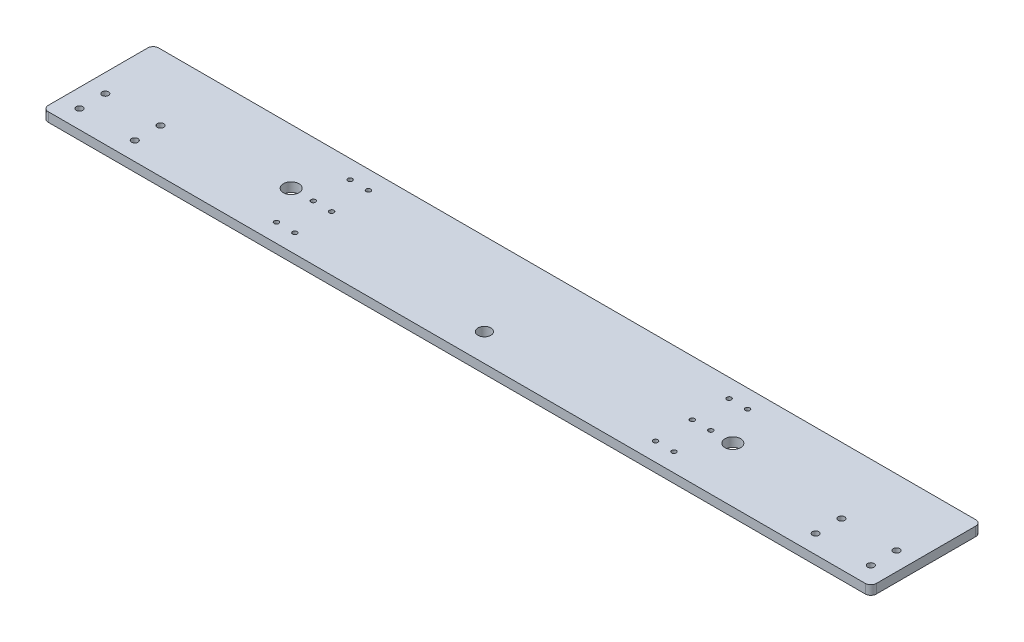
from build123d import *

# Parameters (mm, degrees)
SKETCH_1_W                  = 450
SKETCH_1_H                  = 60
EXTRUDE_1_DEPTH             = 5
SKETCH_2_R                  = 3.5
CUT_EXTRUDE_2_DEPTH         = 228.046250795
SKETCH_4_R                  = 1
CUT_EXTRUDE_4_DEPTH         = 228.046250795
PATTERN_LINEAR_2_COUNT      = 3
PATTERN_LINEAR_2_PITCH      = 20
PATTERN_LINEAR_2_COUNT_DIR2 = 2
PATTERN_LINEAR_2_PITCH_DIR2 = 10
MIRROR_1_COPY_1_SKETCH_R    = 1
MIRROR_1_COPY_1_DEPTH       = 228.046250795
MIRROR_1_COPY_2_SKETCH_R    = 1
MIRROR_1_COPY_2_DEPTH       = 228.046250795
MIRROR_1_COPY_3_SKETCH_R    = 1
MIRROR_1_COPY_3_DEPTH       = 228.046250795
MIRROR_1_COPY_4_SKETCH_R    = 1
MIRROR_1_COPY_4_DEPTH       = 228.046250795
MIRROR_1_COPY_5_SKETCH_R    = 1
MIRROR_1_COPY_5_DEPTH       = 228.046250795
SKETCH_6_R                  = 1.75
CUT_EXTRUDE_5_DEPTH         = 228.046250795
PATTERN_LINEAR_3_COUNT      = 2
PATTERN_LINEAR_3_PITCH      = 14
PATTERN_LINEAR_3_COUNT_DIR2 = 2
PATTERN_LINEAR_3_PITCH_DIR2 = 30
MIRROR_2_COPY_1_SKETCH_R    = 1.75
MIRROR_2_COPY_1_DEPTH       = 228.046250795
MIRROR_2_COPY_2_SKETCH_R    = 1.75
MIRROR_2_COPY_2_DEPTH       = 228.046250795
MIRROR_2_COPY_3_SKETCH_R    = 1.75
MIRROR_2_COPY_3_DEPTH       = 228.046250795
SKETCH_7_R                  = 4.25
CUT_EXTRUDE_6_DEPTH         = 10
FILLET_3_R                  = 3
FILLET_4_R                  = 3
FILLET_5_R                  = 3
FILLET_6_R                  = 3
HOLE_WIZARD_M3_2_D          = 2.5


with BuildPart() as part:
    # 草图1 → 凸台-拉伸1 (new body)
    with BuildSketch(Plane(origin=(0, 0, 0), x_dir=(1, 0, 0), z_dir=(0, 1, 0))):
        Rectangle(SKETCH_1_W, SKETCH_1_H)
    extrude(amount=-EXTRUDE_1_DEPTH)

    # 草图2 → 切除-拉伸2 (cut, through all)
    with BuildSketch(Plane(origin=(0, 0, 0), x_dir=(1, 0, 0), z_dir=(0, 1, 0))):
        with Locations(Location((0, -15, 0), (0, 0, 270))):
            Circle(SKETCH_2_R)
    extrude(amount=-CUT_EXTRUDE_2_DEPTH, mode=Mode.SUBTRACT)

    # 草图4 → 切除-拉伸4 (cut, through all)
    with BuildSketch(Plane(origin=(0, 0, 0), x_dir=(1, 0, 0), z_dir=(0, 1, 0))):
        with Locations(Location((-98, -20, 0), (0, 0, 270))):
            Circle(SKETCH_4_R)
    cut_extrude_4 = extrude(amount=-CUT_EXTRUDE_4_DEPTH, mode=Mode.SUBTRACT)

    # 阵列(线性)2: Cut-Extrude 4 3 × 2
    with Locations(*[(-j * PATTERN_LINEAR_2_PITCH_DIR2, 0, -i * PATTERN_LINEAR_2_PITCH) for i in range(PATTERN_LINEAR_2_COUNT) for j in range(PATTERN_LINEAR_2_COUNT_DIR2) if (i, j) != (0, 0)]):
        add(cut_extrude_4, mode=Mode.SUBTRACT)

    # 镜向1: 切除-拉伸4 across plane
    add(cut_extrude_4.mirror(Plane(origin=(0, 0, 0), x_dir=(0, 0, 1), z_dir=(1, 0, 0))), mode=Mode.SUBTRACT)

    # 镜向1 copy 1 sketch → 镜向1 copy 1 (cut, through all)
    with BuildSketch(Plane(origin=(10, 0, 0), x_dir=(-1, 0, 0), z_dir=(0, 1, 0))):
        with Locations((-98, 20)):
            Circle(MIRROR_1_COPY_1_SKETCH_R)
    extrude(amount=-MIRROR_1_COPY_1_DEPTH, mode=Mode.SUBTRACT)

    # 镜向1 copy 2 sketch → 镜向1 copy 2 (cut, through all)
    with BuildSketch(Plane(origin=(0, 0, -20), x_dir=(-1, 0, 0), z_dir=(0, 1, 0))):
        with Locations((-98, 20)):
            Circle(MIRROR_1_COPY_2_SKETCH_R)
    extrude(amount=-MIRROR_1_COPY_2_DEPTH, mode=Mode.SUBTRACT)

    # 镜向1 copy 3 sketch → 镜向1 copy 3 (cut, through all)
    with BuildSketch(Plane(origin=(10, 0, -20), x_dir=(-1, 0, 0), z_dir=(0, 1, 0))):
        with Locations((-98, 20)):
            Circle(MIRROR_1_COPY_3_SKETCH_R)
    extrude(amount=-MIRROR_1_COPY_3_DEPTH, mode=Mode.SUBTRACT)

    # 镜向1 copy 4 sketch → 镜向1 copy 4 (cut, through all)
    with BuildSketch(Plane(origin=(0, 0, -40), x_dir=(-1, 0, 0), z_dir=(0, 1, 0))):
        with Locations((-98, 20)):
            Circle(MIRROR_1_COPY_4_SKETCH_R)
    extrude(amount=-MIRROR_1_COPY_4_DEPTH, mode=Mode.SUBTRACT)

    # 镜向1 copy 5 sketch → 镜向1 copy 5 (cut, through all)
    with BuildSketch(Plane(origin=(10, 0, -40), x_dir=(-1, 0, 0), z_dir=(0, 1, 0))):
        with Locations((-98, 20)):
            Circle(MIRROR_1_COPY_5_SKETCH_R)
    extrude(amount=-MIRROR_1_COPY_5_DEPTH, mode=Mode.SUBTRACT)

    # 草图6 → 切除-拉伸5 (cut, through all)
    with BuildSketch(Plane(origin=(0, 0, 0), x_dir=(1, 0, 0), z_dir=(0, 1, 0))):
        with Locations(Location((-215, -20, 0), (0, 0, 270))):
            Circle(SKETCH_6_R)
    cut_extrude_5 = extrude(amount=-CUT_EXTRUDE_5_DEPTH, mode=Mode.SUBTRACT)

    # 阵列(线性)3: Cut-Extrude 5 2 × 2
    with Locations(*[(j * PATTERN_LINEAR_3_PITCH_DIR2, 0, -i * PATTERN_LINEAR_3_PITCH) for i in range(PATTERN_LINEAR_3_COUNT) for j in range(PATTERN_LINEAR_3_COUNT_DIR2) if (i, j) != (0, 0)]):
        add(cut_extrude_5, mode=Mode.SUBTRACT)

    # 镜向2: 切除-拉伸5 across plane
    add(cut_extrude_5.mirror(Plane(origin=(0, 0, 0), x_dir=(0, 0, 1), z_dir=(1, 0, 0))), mode=Mode.SUBTRACT)

    # 镜向2 copy 1 sketch → 镜向2 copy 1 (cut, through all)
    with BuildSketch(Plane(origin=(-30, 0, 0), x_dir=(-1, 0, 0), z_dir=(0, 1, 0))):
        with Locations((-215, 20)):
            Circle(MIRROR_2_COPY_1_SKETCH_R)
    extrude(amount=-MIRROR_2_COPY_1_DEPTH, mode=Mode.SUBTRACT)

    # 镜向2 copy 2 sketch → 镜向2 copy 2 (cut, through all)
    with BuildSketch(Plane(origin=(0, 0, -14), x_dir=(-1, 0, 0), z_dir=(0, 1, 0))):
        with Locations((-215, 20)):
            Circle(MIRROR_2_COPY_2_SKETCH_R)
    extrude(amount=-MIRROR_2_COPY_2_DEPTH, mode=Mode.SUBTRACT)

    # 镜向2 copy 3 sketch → 镜向2 copy 3 (cut, through all)
    with BuildSketch(Plane(origin=(-30, 0, -14), x_dir=(-1, 0, 0), z_dir=(0, 1, 0))):
        with Locations((-215, 20)):
            Circle(MIRROR_2_COPY_3_SKETCH_R)
    extrude(amount=-MIRROR_2_COPY_3_DEPTH, mode=Mode.SUBTRACT)

    # 草图7 → 切除-拉伸6 (cut)
    with BuildSketch(Plane(origin=(0, 0, 0), x_dir=(1, 0, 0), z_dir=(0, 1, 0))):
        with Locations(Location((-120, 0, 0), (0, 0, 270))):
            Circle(SKETCH_7_R)
    cut_extrude_6 = extrude(amount=-CUT_EXTRUDE_6_DEPTH, mode=Mode.SUBTRACT)

    # 镜向3: 切除-拉伸6 across plane
    add(cut_extrude_6.mirror(Plane(origin=(0, 0, 0), x_dir=(0, 0, 1), z_dir=(1, 0, 0))), mode=Mode.SUBTRACT)

    # 圆角3
    fillet_3_edges = [part.edges().sort_by_distance(p)[0] for p in [
        (-225, -2.5, 30),
    ]]
    fillet(fillet_3_edges, radius=FILLET_3_R)

    # 圆角4
    fillet_4_edges = [part.edges().sort_by_distance(p)[0] for p in [
        (-225, -2.5, -30),
    ]]
    fillet(fillet_4_edges, radius=FILLET_4_R)

    # 圆角5
    fillet_5_edges = [part.edges().sort_by_distance(p)[0] for p in [
        (225, -2.5, -30),
    ]]
    fillet(fillet_5_edges, radius=FILLET_5_R)

    # 圆角6
    fillet_6_edges = [part.edges().sort_by_distance(p)[0] for p in [
        (225, -2.5, 30),
    ]]
    fillet(fillet_6_edges, radius=FILLET_6_R)

    # M3 螺纹孔2 (through all)
    with Locations(Plane(origin=(0, 0, 0), x_dir=(1, 0, 0), z_dir=(0, 1, 0))):
        with Locations((-98, -20), (-98, 0), (-98, 20), (-108, 20), (-108, 0), (-108, -20), (98, -20), (108, -20), (98, 0), (108, 0), (108, 20), (98, 20)):
            Hole(HOLE_WIZARD_M3_2_D / 2)


solid = part.part
